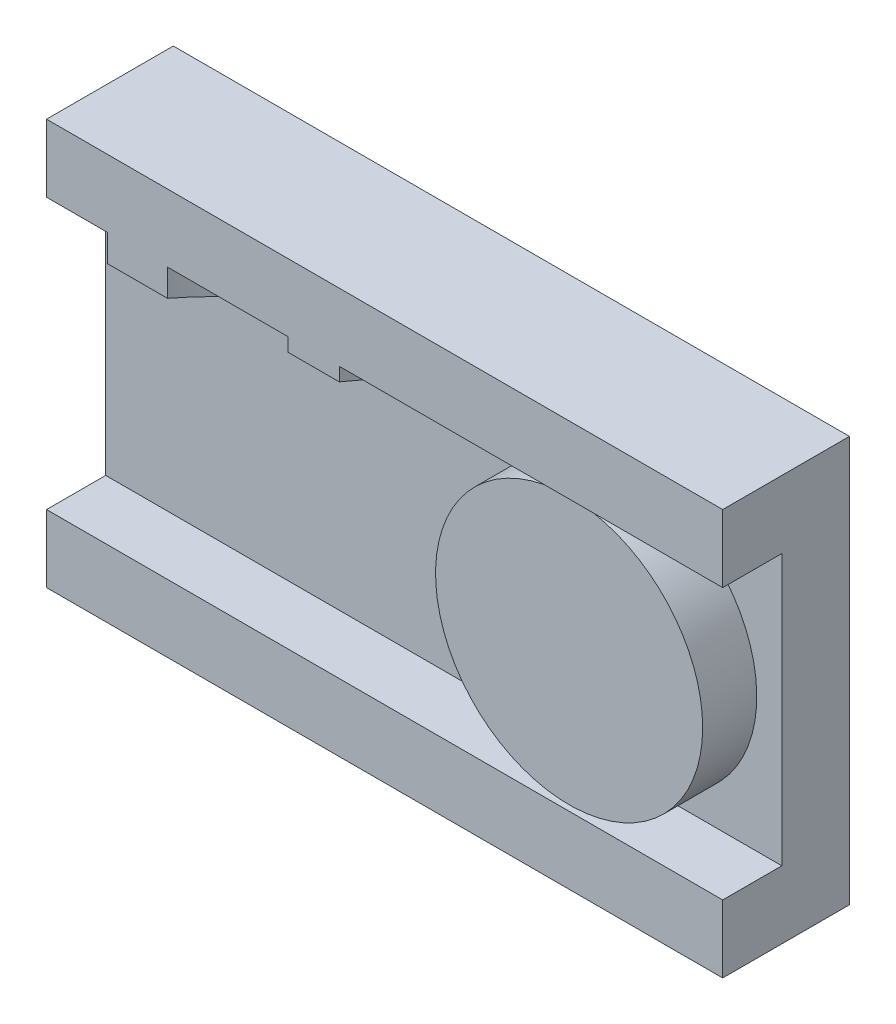
from build123d import *

# Parameters (mm, degrees)
SKETCH1_W           = 5
SKETCH1_H           = 20
SKETCH1_W_2         = 20
SKETCH1_H_2         = 5
BOSS_EXTRUDE2_DEPTH = 50
BOSS_EXTRUDE3_DEPTH = 2
BOSS_EXTRUDE4_DEPTH = 1
SKETCH5_W           = 10.627555573
SKETCH5_H           = 30
CUT_EXTRUDE1_DEPTH  = 410
SKETCH6_R           = 9.876593792
BOSS_EXTRUDE5_DEPTH = 4


with BuildPart() as part:
    # Sketch1 → Boss-Extrude2 (new body)
    with BuildSketch(Plane(origin=(0, 0, 0), x_dir=(0, 0, -1), z_dir=(1, 0, 0))):
        with Locations((11.964285714, 8.526785714)):
            Rectangle(SKETCH1_W, SKETCH1_H)
        with Locations((4.464285714, 21.026785714)):
            Rectangle(SKETCH1_W_2, SKETCH1_H_2)
        with Locations((4.464285714, -3.973214286)):
            Rectangle(SKETCH1_W_2, SKETCH1_H_2)
    extrude(amount=BOSS_EXTRUDE2_DEPTH)

    # Sketch2 → Boss-Extrude3 (add)
    with BuildSketch(Plane.XZ.offset(-18.526785714)):
        with BuildLine():
            Line((4.515759803, -9.464285714), (4.515759803, 5.535714286))
            add(Edge.make_bspline(
                [(4.515759803, 5.535714286), (5.848786982, -3.806136343), (13.48902105, -9.464285714)],
                knots=[0, 0, 0, 1, 1, 1], degree=2))
            Line((13.48902105, -9.464285714), (4.515759803, -9.464285714))
        make_face()
    extrude(amount=BOSS_EXTRUDE3_DEPTH)

    # Sketch4 → Boss-Extrude4 (add)
    with BuildSketch(Plane.XZ.offset(-18.526785714)):
        with BuildLine():
            Line((17.865518754, -10.317847861), (17.865518754, 5.535714286))
            add(Edge.make_bspline(
                [(17.865518754, 5.535714286), (18.795797839, -4.399262704), (26.838780001, -10.317847861)],
                knots=[0, 0, 0, 1, 1, 1], degree=2))
            Line((26.838780001, -10.317847861), (17.865518754, -10.317847861))
        make_face()
    extrude(amount=BOSS_EXTRUDE4_DEPTH)

    # Sketch5 → Cut-Extrude1 (cut)
    with BuildSketch(Plane(origin=(50, 0, 0), x_dir=(0, 0, -1), z_dir=(1, 0, 0))):
        with Locations((-0.221936499, 8.526785714)):
            Rectangle(SKETCH5_W, SKETCH5_H)
    extrude(amount=-CUT_EXTRUDE1_DEPTH, mode=Mode.SUBTRACT)

    # Sketch6 → Boss-Extrude5 (add)
    with BuildSketch(Plane.XY.offset(-9.464285714)):
        with Locations(Location((38.269602277, 8.445873505, 0), (0, 0, 90))):
            Circle(SKETCH6_R)
    extrude(amount=BOSS_EXTRUDE5_DEPTH)


solid = part.part
